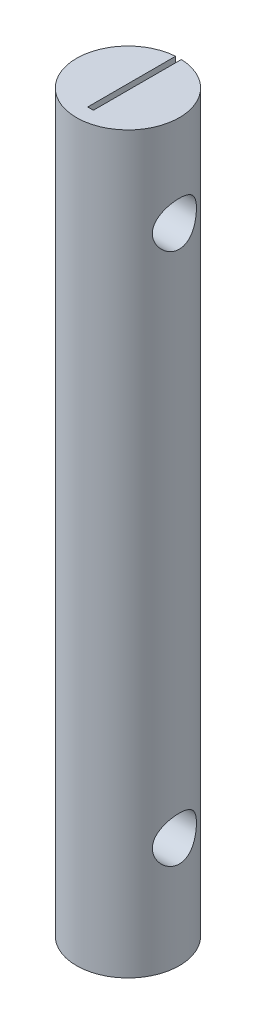
from build123d import *

# Parameters (mm, degrees)
SKETCH1_R               = 7
BOSS_EXTRUDE1_DEPTH     = 100
SKETCH2_W               = 0.776080751
SKETCH2_H               = 12.3835138
CUT_EXTRUDE1_DEPTH      = 40
CUT_EXTRUDE2_DEPTH      = 40
CUT_EXTRUDE2_DEPTH_BACK = 40
SKETCH3_R               = 3


with BuildPart() as part:
    # Sketch1 → Boss-Extrude1 (new body)
    with BuildSketch(Plane(origin=(0, 0, 0), x_dir=(1, 0, 0), z_dir=(0, 1, 0))):
        with Locations(Location((0, 0, 0), (0, 0, 270))):
            Circle(SKETCH1_R)
    extrude(amount=BOSS_EXTRUDE1_DEPTH)

    # Sketch2 → Cut-Extrude1 (cut)
    with BuildSketch(Plane(origin=(0, 100, 0), x_dir=(1, 0, 0), z_dir=(0, 1, 0))):
        with Locations((-0.111959624, 1.211880607)):
            Rectangle(SKETCH2_W, SKETCH2_H)
    extrude(amount=-CUT_EXTRUDE1_DEPTH, mode=Mode.SUBTRACT)

    # Sketch3 → Cut-Extrude2 (cut, two sides: drawn at the far end of the back side and taken through both)
    with BuildSketch(Plane(origin=(0, 0, 0), x_dir=(0, 0, -1), z_dir=(1, 0, 0)).offset(-CUT_EXTRUDE2_DEPTH_BACK)):
        with Locations(Location((-0.002723223, 15, 0), (0, 0, 180))):
            Circle(SKETCH3_R)
        with Locations(Location((-0.002723223, 87.495749825, 0), (0, 0, 180))):
            Circle(SKETCH3_R)
    extrude(amount=CUT_EXTRUDE2_DEPTH + CUT_EXTRUDE2_DEPTH_BACK, mode=Mode.SUBTRACT)


solid = part.part
